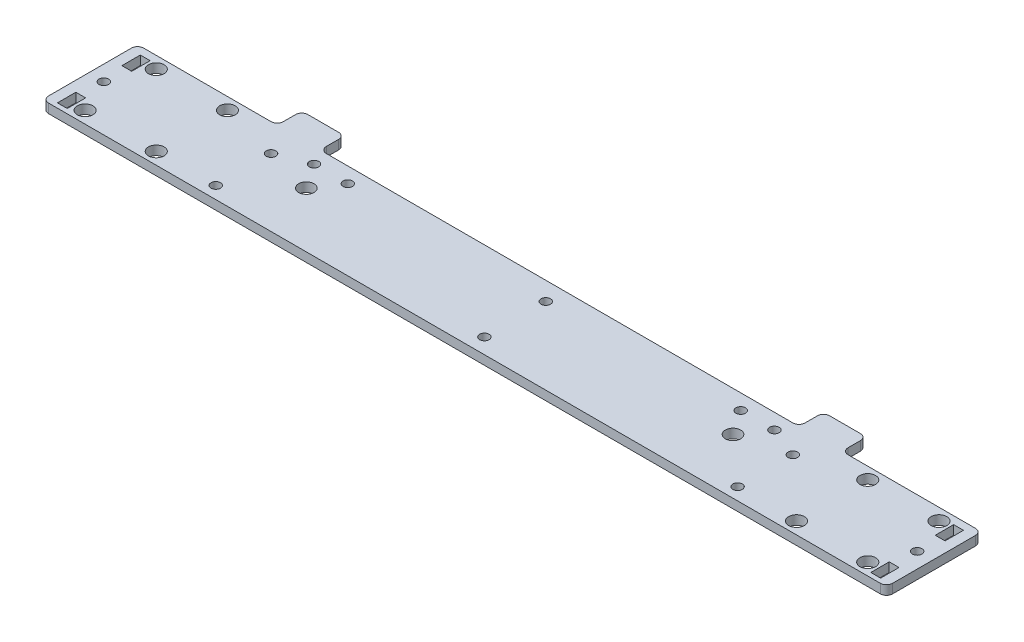
from build123d import *

# Parameters (mm, degrees)
CROQUIS1_R              = 1.55
CROQUIS1_R_2            = 2.55
CROQUIS1_R_3            = 2.5
CROQUIS1_W              = 3.2
CROQUIS1_H              = 6
SALIENTE_EXTRUIR1_DEPTH = 3
REDONDEO2_R             = 2


with BuildPart() as part:
    # Croquis1 → Saliente-Extruir1 (new body)
    with BuildSketch(Plane(origin=(0, 0, 0), x_dir=(1, 0, 0), z_dir=(0, 1, 0))):
        Polygon((0, 0), (275, 0), (275, 31), (229.5, 31), (229.5, 39), (215.5, 39), (215.5, 31), (59.5, 31), (59.5, 39), (45.5, 39), (45.5, 31), (0, 31), align=None)
        with Locations(Location((5, 15, 0), (0, 0, 270))):
            Circle(CROQUIS1_R, mode=Mode.SUBTRACT)
        with Locations(Location((270, 15, 0), (0, 0, 90))):
            Circle(CROQUIS1_R, mode=Mode.SUBTRACT)
        with Locations(Location((10, 27.1, 0), (0, 0, 270))):
            Circle(CROQUIS1_R_2, mode=Mode.SUBTRACT)
        with Locations(Location((33.2, 27.1, 0), (0, 0, 270))):
            Circle(CROQUIS1_R_2, mode=Mode.SUBTRACT)
        with Locations(Location((33.2, 3.9, 0), (0, 0, 270))):
            Circle(CROQUIS1_R_2, mode=Mode.SUBTRACT)
        with Locations(Location((10, 3.9, 0), (0, 0, 270))):
            Circle(CROQUIS1_R_2, mode=Mode.SUBTRACT)
        with Locations(Location((265, 3.9, 0), (0, 0, 90))):
            Circle(CROQUIS1_R_2, mode=Mode.SUBTRACT)
        with Locations(Location((241.8, 3.9, 0), (0, 0, 90))):
            Circle(CROQUIS1_R_2, mode=Mode.SUBTRACT)
        with Locations(Location((265, 27.1, 0), (0, 0, 90))):
            Circle(CROQUIS1_R_2, mode=Mode.SUBTRACT)
        with Locations(Location((241.8, 27.1, 0), (0, 0, 90))):
            Circle(CROQUIS1_R_2, mode=Mode.SUBTRACT)
        with Locations(Location((139, 25, 0), (0, 0, 270))):
            Circle(CROQUIS1_R, mode=Mode.SUBTRACT)
        with Locations(Location((139, 5, 0), (0, 0, 270))):
            Circle(CROQUIS1_R, mode=Mode.SUBTRACT)
        with Locations(Location((52.5, 22, 0), (0, 0, 270))):
            Circle(CROQUIS1_R, mode=Mode.SUBTRACT)
        with Locations(Location((52.5, 4, 0), (0, 0, 270))):
            Circle(CROQUIS1_R, mode=Mode.SUBTRACT)
        with Locations(Location((222.5, 22, 0), (0, 0, 90))):
            Circle(CROQUIS1_R, mode=Mode.SUBTRACT)
        with Locations(Location((222.5, 4, 0), (0, 0, 90))):
            Circle(CROQUIS1_R, mode=Mode.SUBTRACT)
        with Locations(Location((212.5, 26, 0), (0, 0, 270))):
            Circle(CROQUIS1_R, mode=Mode.SUBTRACT)
        with Locations(Location((62.5, 26, 0), (0, 0, 90))):
            Circle(CROQUIS1_R, mode=Mode.SUBTRACT)
        with Locations(Location((201.5, 26, 0), (0, 0, 270))):
            Circle(CROQUIS1_R, mode=Mode.SUBTRACT)
        with Locations(Location((73.5, 26, 0), (0, 0, 90))):
            Circle(CROQUIS1_R, mode=Mode.SUBTRACT)
        with Locations(Location((207, 18, 0), (0, 0, 270))):
            Circle(CROQUIS1_R_3, mode=Mode.SUBTRACT)
        with Locations(Location((68, 18, 0), (0, 0, 90))):
            Circle(CROQUIS1_R_3, mode=Mode.SUBTRACT)
        with Locations((270, 4.5)):
            Rectangle(CROQUIS1_W, CROQUIS1_H, mode=Mode.SUBTRACT)
        with Locations((5, 25.5)):
            Rectangle(CROQUIS1_W, CROQUIS1_H, mode=Mode.SUBTRACT)
        with Locations((5, 4.5)):
            Rectangle(CROQUIS1_W, CROQUIS1_H, mode=Mode.SUBTRACT)
        with Locations((270, 25.5)):
            Rectangle(CROQUIS1_W, CROQUIS1_H, mode=Mode.SUBTRACT)
    extrude(amount=SALIENTE_EXTRUIR1_DEPTH)

    # Redondeo2
    redondeo2_edges = [part.edges().sort_by_distance(p)[0] for p in [
        (0, 1.5, -31),
        (45.5, 1.5, -31),
        (45.5, 1.5, -39),
        (59.5, 1.5, -39),
        (59.5, 1.5, -31),
        (215.5, 1.5, -31),
        (215.5, 1.5, -39),
        (229.5, 1.5, -39),
        (229.5, 1.5, -31),
        (275, 1.5, -31),
        (275, 1.5, 0),
        (0, 1.5, 0),
    ]]
    fillet(redondeo2_edges, radius=REDONDEO2_R)


solid = part.part
